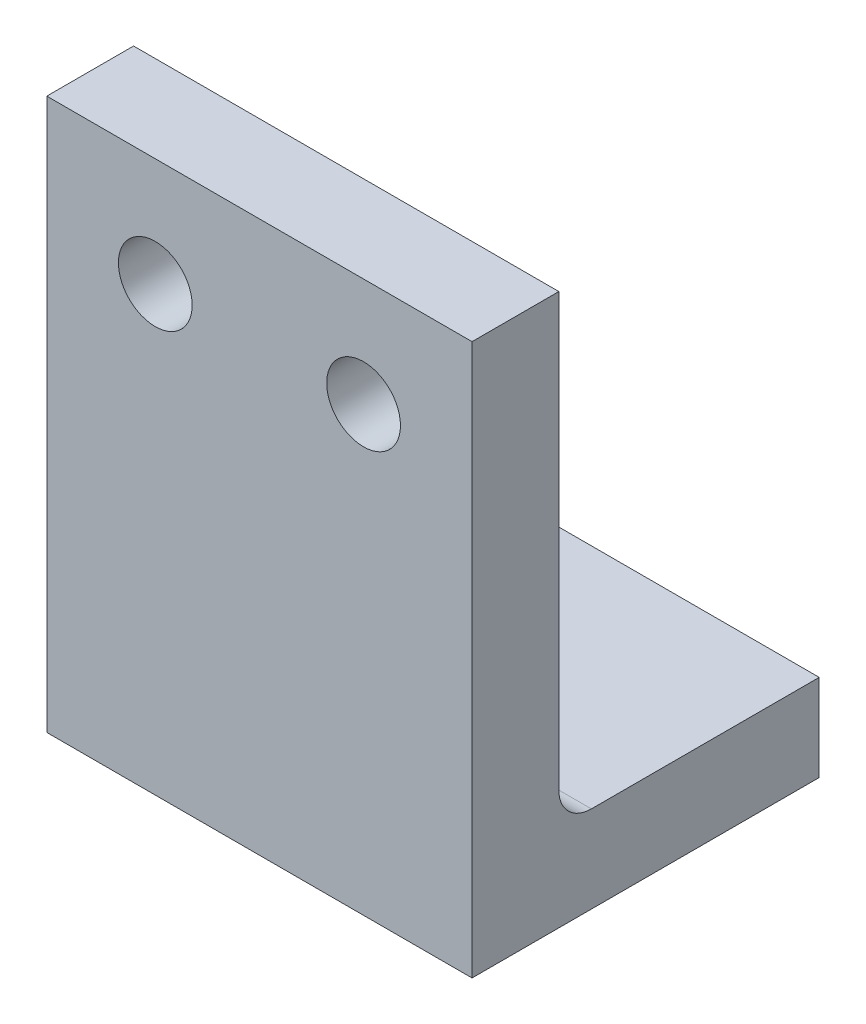
from build123d import *

# Parameters (mm, degrees)
SKETCH1_W           = 19.6
SKETCH1_H           = 21.4
SKETCH1_R           = 1.7
BOSS_EXTRUDE1_DEPTH = 4
SKETCH3_W           = 19.6
SKETCH3_H           = 16
BOSS_EXTRUDE2_DEPTH = 4
FILLET1_R           = 1.5


with BuildPart() as part:
    # Sketch1 → Boss-Extrude1 (new body)
    with BuildSketch(Plane.XY):
        with Locations((0, -5.7)):
            Rectangle(SKETCH1_W, SKETCH1_H)
        with Locations((-4.8, 0)):
            Circle(SKETCH1_R, mode=Mode.SUBTRACT)
        with Locations((4.8, 0)):
            Circle(SKETCH1_R, mode=Mode.SUBTRACT)
    extrude(amount=BOSS_EXTRUDE1_DEPTH)

    # Sketch3 → Boss-Extrude2 (add)
    with BuildSketch(Plane.XZ.offset(16.4)):
        with Locations((0, -4)):
            Rectangle(SKETCH3_W, SKETCH3_H)
    extrude(amount=BOSS_EXTRUDE2_DEPTH)

    # Fillet1
    fillet1_edges = [part.edges().sort_by_distance(p)[0] for p in [
        (0, -16.4, 0),
    ]]
    fillet(fillet1_edges, radius=FILLET1_R)


solid = part.part
